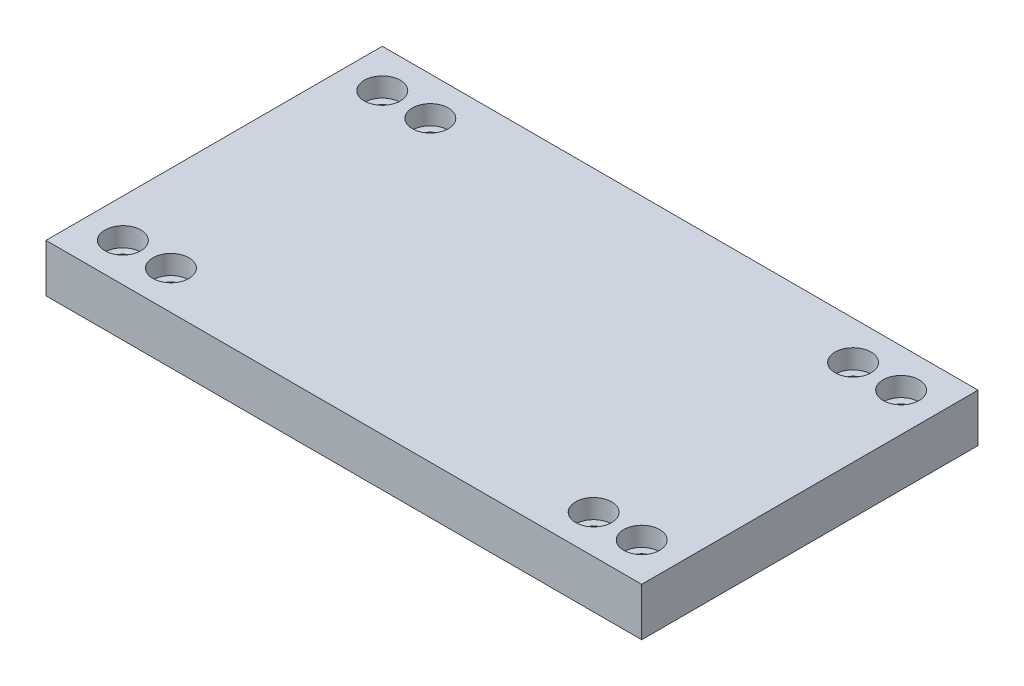
from build123d import *

# Parameters (mm, degrees)
SKETCH1_W           = 124
SKETCH1_H           = 70
BOSS_EXTRUDE1_DEPTH = 10
SKETCH11_R          = 2.15
CUT_EXTRUDE4_DEPTH  = 79.938779664
SKETCH17_R          = 3.75
CUT_EXTRUDE5_DEPTH  = 4


with BuildPart() as part:
    # Sketch1 → Boss-Extrude1 (new body)
    with BuildSketch(Plane(origin=(0, 0, 0), x_dir=(1, 0, 0), z_dir=(0, 1, 0))):
        with Locations((3.263157895, -8.267206478)):
            Rectangle(SKETCH1_W, SKETCH1_H)
    extrude(amount=BOSS_EXTRUDE1_DEPTH)

    # Sketch11 → Cut-Extrude4 (cut, through all)
    with BuildSketch(Plane(origin=(0, 10, 0), x_dir=(1, 0, 0), z_dir=(0, 1, 0))):
        with Locations(Location((-50.736842105, 18.732793522, 0), (0, 0, 270))):
            Circle(SKETCH11_R)
        with Locations(Location((-40.736842105, 18.732793522, 0), (0, 0, 270))):
            Circle(SKETCH11_R)
        with Locations(Location((-50.736842105, -35.267206478, 0), (0, 0, 270))):
            Circle(SKETCH11_R)
        with Locations(Location((-40.736842105, -35.267206478, 0), (0, 0, 270))):
            Circle(SKETCH11_R)
        with Locations(Location((47.263157895, 18.732793522, 0), (0, 0, 270))):
            Circle(SKETCH11_R)
        with Locations(Location((57.263157895, 18.732793522, 0), (0, 0, 270))):
            Circle(SKETCH11_R)
        with Locations(Location((47.263157895, -35.267206478, 0), (0, 0, 270))):
            Circle(SKETCH11_R)
        with Locations(Location((57.263157895, -35.267206478, 0), (0, 0, 270))):
            Circle(SKETCH11_R)
    extrude(amount=-CUT_EXTRUDE4_DEPTH, mode=Mode.SUBTRACT)

    # Sketch17 → Cut-Extrude5 (cut)
    with BuildSketch(Plane(origin=(0, 10, 0), x_dir=(1, 0, 0), z_dir=(0, 1, 0))):
        with Locations(Location((-50.736842105, 18.732793522, 0), (0, 0, 270))):
            Circle(SKETCH17_R)
        with Locations(Location((-40.736842105, 18.732793522, 0), (0, 0, 270))):
            Circle(SKETCH17_R)
        with Locations(Location((47.263157895, 18.732793522, 0), (0, 0, 270))):
            Circle(SKETCH17_R)
        with Locations(Location((57.263157895, 18.732793522, 0), (0, 0, 270))):
            Circle(SKETCH17_R)
        with Locations(Location((57.263157895, -35.267206478, 0), (0, 0, 270))):
            Circle(SKETCH17_R)
        with Locations(Location((47.263157895, -35.267206478, 0), (0, 0, 270))):
            Circle(SKETCH17_R)
        with Locations(Location((-40.736842105, -35.267206478, 0), (0, 0, 270))):
            Circle(SKETCH17_R)
        with Locations(Location((-50.736842105, -35.267206478, 0), (0, 0, 270))):
            Circle(SKETCH17_R)
    extrude(amount=-CUT_EXTRUDE5_DEPTH, mode=Mode.SUBTRACT)


solid = part.part
